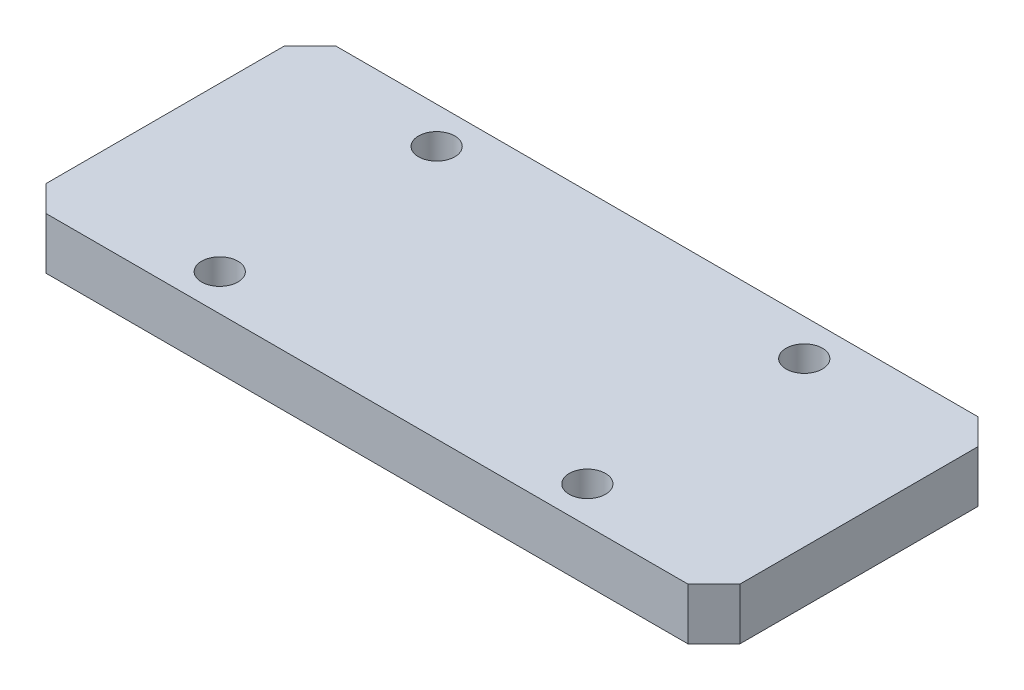
from build123d import *

# Parameters (mm, degrees)
BOSS_EXTRUDE1_DEPTH = 56
SKETCH3_R           = 3.5
CUT_EXTRUDE1_DEPTH  = 10
CHAMFER1_SIZE       = 5


with BuildPart() as part:
    # Sketch2 → Boss-Extrude1 (new body)
    with BuildSketch(Plane.XY):
        Polygon((46, 10), (-46, 10), (-67, 10), (-67, 0), (-45, 0), (45, 0), (67, 0), (67, 10), align=None)
    extrude(amount=BOSS_EXTRUDE1_DEPTH)

    # Sketch3 → Cut-Extrude1 (cut)
    with BuildSketch(Plane(origin=(0, 10, 0), x_dir=(1, 0, 0), z_dir=(0, 1, 0))):
        with Locations(Location((-35.5, -7.055, 0), (0, 0, 180))):
            Circle(SKETCH3_R)
        with Locations(Location((35.5, -7.055, 0), (0, 0, 180))):
            Circle(SKETCH3_R)
        with Locations(Location((-35.5, -48.945, 0), (0, 0, 180))):
            Circle(SKETCH3_R)
        with Locations(Location((35.5, -48.945, 0), (0, 0, 180))):
            Circle(SKETCH3_R)
    extrude(amount=-CUT_EXTRUDE1_DEPTH, mode=Mode.SUBTRACT)

    # Chamfer1
    chamfer1_edges = [part.edges().sort_by_distance(p)[0] for p in [
        (67, 5, 0),
        (-67, 5, 56),
        (67, 5, 56),
        (-67, 5, 0),
    ]]
    chamfer(chamfer1_edges, length=CHAMFER1_SIZE)


solid = part.part
